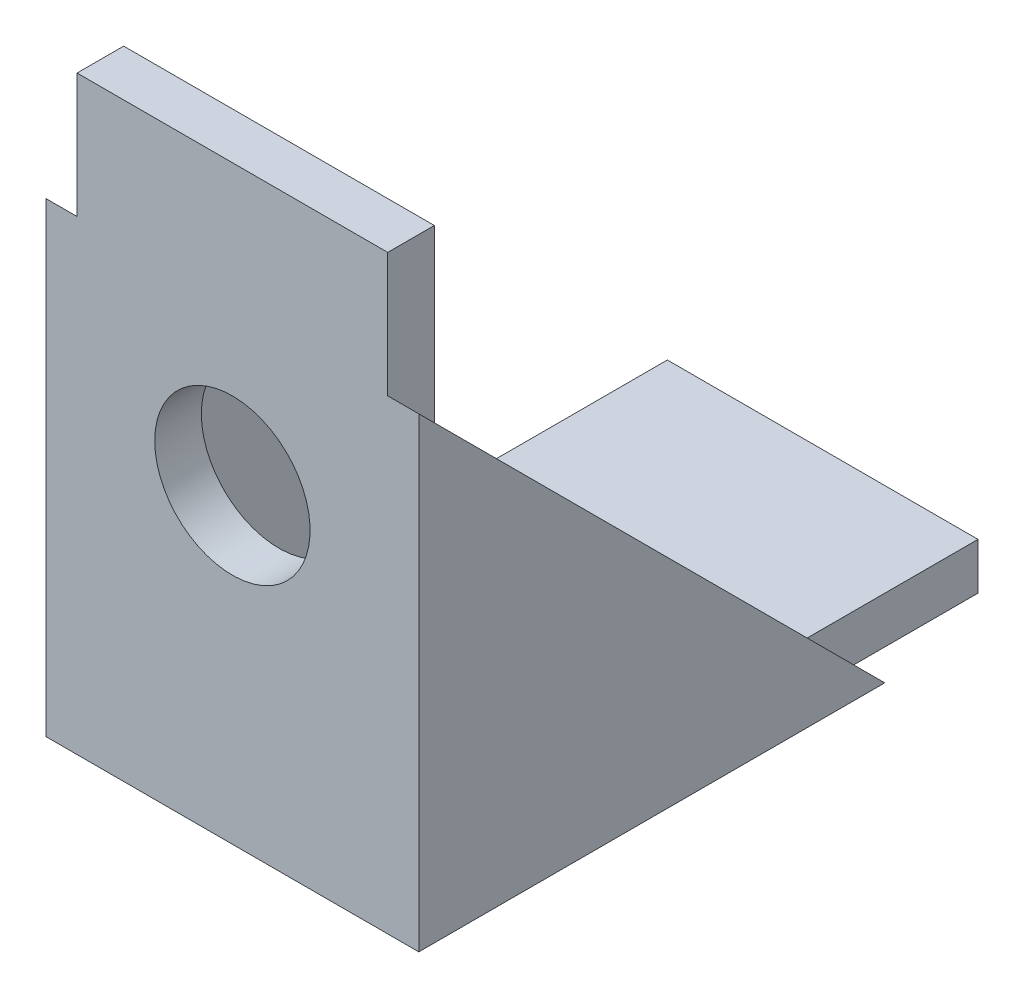
from build123d import *

# Parameters (mm, degrees)
EXTRUDE_1_DEPTH     = 20
SKETCH_3_R          = 1.5
CUT_EXTRUDE_1_DEPTH = 56.398555938
SKETCH_5_R          = 5
CUT_EXTRUDE_3_DEPTH = 56.398555938
EXTRUDE_2_DEPTH     = 2
EXTRUDE_3_DEPTH     = 2


with BuildPart() as part:
    # 草图1 → 凸台-拉伸1 (new body)
    with BuildSketch(Plane(origin=(0, 0, 0), x_dir=(0, 0, -1), z_dir=(1, 0, 0))):
        Polygon((0, 0), (0, 38), (3, 38), (3, 3), (38, 3), (38, 0), align=None)
    extrude(amount=EXTRUDE_1_DEPTH)

    # 草图3 → 切除-拉伸1 (cut, through all)
    with BuildSketch(Plane(origin=(0, 3, 0), x_dir=(1, 0, 0), z_dir=(0, 1, 0))):
        with Locations(Location((16, 12, 0), (0, 0, 270))):
            Circle(SKETCH_3_R)
        with Locations(Location((4, 12, 0), (0, 0, 270))):
            Circle(SKETCH_3_R)
        with Locations(Location((4, 24, 0), (0, 0, 270))):
            Circle(SKETCH_3_R)
        with Locations(Location((16, 24, 0), (0, 0, 270))):
            Circle(SKETCH_3_R)
    extrude(amount=-CUT_EXTRUDE_1_DEPTH, mode=Mode.SUBTRACT)

    # 草图5 → 切除-拉伸3 (cut, through all)
    with BuildSketch(Plane(origin=(0, 0, -3), x_dir=(-1, 0, 0), z_dir=(0, 0, -1))):
        with Locations((-10, 20)):
            Circle(SKETCH_5_R)
    extrude(amount=-CUT_EXTRUDE_3_DEPTH, mode=Mode.SUBTRACT)

    # 草图6 → 凸台-拉伸2 (add)
    with BuildSketch(Plane.ZY):
        Polygon((0, 0), (0, 30), (-30, 0), align=None)
    extrude(amount=EXTRUDE_2_DEPTH)

    # 草图7 → 凸台-拉伸3 (add)
    with BuildSketch(Plane(origin=(20, 0, 0), x_dir=(0, 0, -1), z_dir=(1, 0, 0))):
        Polygon((0, 0), (0, 30), (30, 0), align=None)
    extrude(amount=EXTRUDE_3_DEPTH)


solid = part.part
